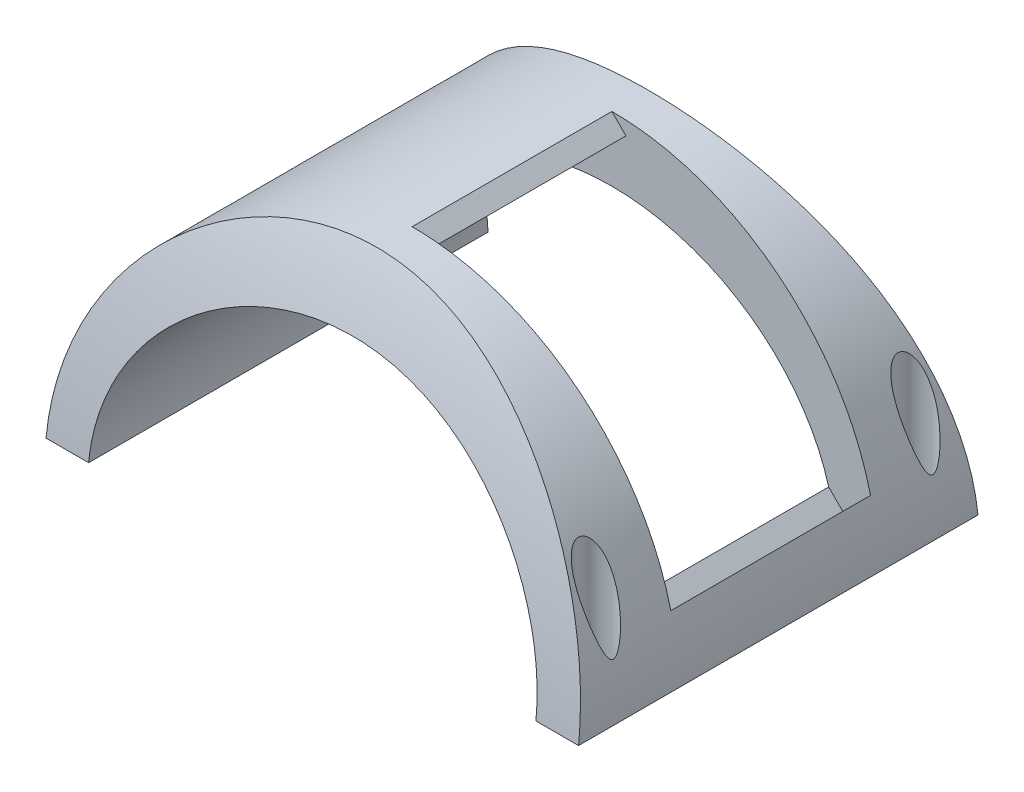
from build123d import *

# Parameters (mm, degrees)
SKETCH1_W               = 101.6
SKETCH1_H               = 76.2
BOSS_EXTRUDE1_DEPTH     = 2.54
SKETCH2_W               = 101.6
SKETCH2_H               = 76.2
BOSS_EXTRUDE2_DEPTH     = 24.638
SKETCH3_W               = 101.6
SKETCH3_H               = 76.2
BOSS_EXTRUDE3_DEPTH     = 50.8
CUT_EXTRUDE8_DEPTH      = 150.028750528
CUT_EXTRUDE9_DEPTH      = 150.0287507
CUT_EXTRUDE10_DEPTH     = 150.0287507
CUT_EXTRUDE11_DEPTH     = 150.0287507
SKETCH8_W               = 21.414745162
SKETCH8_H               = 38.1
CUT_EXTRUDE12_DEPTH     = 153.384018497
BOSS_EXTRUDE4_DEPTH     = 41.402
SKETCH10_W              = 38.1
SKETCH10_H              = 19.466312833
CUT_EXTRUDE13_DEPTH     = 19.558
BOSS_EXTRUDE5_DEPTH     = 44.958
SKETCH13_W              = 101.6
SKETCH13_H              = 27.178
CUT_EXTRUDE14_DEPTH     = 150.0287507
SKETCH14_R              = 1.7526
CUT_EXTRUDE15_DEPTH     = 150.0287507
MIRROR2_COPY_1_SKETCH_R = 1.7526
MIRROR2_COPY_1_DEPTH    = 150.0287507
MIRROR2_COPY_2_SKETCH_R = 1.7526
MIRROR2_COPY_2_DEPTH    = 150.0287507
CUT_EXTRUDE16_START     = 30.48
SKETCH16_R              = 3.3274
CUT_EXTRUDE16_DEPTH     = 119.5487507
MIRROR4_START           = 30.48
MIRROR4_COPY_1_SKETCH_R = 3.3274
MIRROR4_COPY_1_DEPTH    = 119.5487507
MIRROR4_COPY_2_SKETCH_R = 3.3274
MIRROR4_COPY_2_DEPTH    = 119.5487507


with BuildPart() as part:
    # Sketch1 → Boss-Extrude1 (new body)
    with BuildSketch(Plane(origin=(0, 0, 0), x_dir=(1, 0, 0), z_dir=(0, 1, 0))):
        with Locations((50.8, 38.1)):
            Rectangle(SKETCH1_W, SKETCH1_H)
    extrude(amount=BOSS_EXTRUDE1_DEPTH)

    # Sketch2 → Boss-Extrude2 (add)
    with BuildSketch(Plane(origin=(0, 2.54, 0), x_dir=(1, 0, 0), z_dir=(0, 1, 0))):
        with Locations((50.8, 38.1)):
            Rectangle(SKETCH2_W, SKETCH2_H)
    extrude(amount=BOSS_EXTRUDE2_DEPTH)



with BuildPart() as body_2:
    # Sketch3 → Boss-Extrude3 (new body)
    with BuildSketch(Plane(origin=(0, 27.178, 0), x_dir=(1, 0, 0), z_dir=(0, 1, 0))):
        with Locations((50.8, 38.1)):
            Rectangle(SKETCH3_W, SKETCH3_H)
    extrude(amount=BOSS_EXTRUDE3_DEPTH)

    # Sketch5 → Cut-Extrude8 (cut, through all)
    with BuildSketch(Plane.XY):
        with BuildLine():
            Line((50.8, 77.978), (0, 77.978))
            Line((0, 77.978), (0, 27.178))
            add(Edge.make_bspline(
                [(50.8, 77.978), (0, 77.978), (0, 27.178)],
                knots=[4.71238898, 4.71238898, 4.71238898, 6.283185307, 6.283185307, 6.283185307], degree=2, weights=[1, 0.707106781, 1]))
        make_face()
    extrude(amount=-CUT_EXTRUDE8_DEPTH, mode=Mode.SUBTRACT)

    # Sketch5<3> → Cut-Extrude9 (cut, through all)
    with BuildSketch(Plane.XY):
        with BuildLine():
            Line((101.6, 77.978), (50.8, 77.978))
            add(Edge.make_bspline(
                [(101.6, 27.178), (101.6, 77.978), (50.8, 77.978)],
                knots=[3.141592654, 3.141592654, 3.141592654, 4.71238898, 4.71238898, 4.71238898], degree=2, weights=[1, 0.707106781, 1]))
            Line((101.6, 27.178), (101.6, 77.978))
        make_face()
    extrude(amount=-CUT_EXTRUDE9_DEPTH, mode=Mode.SUBTRACT)

    # Sketch6 → Cut-Extrude10 (cut, through all)
    with BuildSketch(Plane(origin=(101.6, 0, 0), x_dir=(0, 0, -1), z_dir=(1, 0, 0))):
        with BuildLine():
            add(Edge.make_bspline(
                [(76.2, 27.178), (73.121610085, 57.407688579), (64.140209771, 77.978)],
                knots=[1.837829398, 1.837829398, 1.837829398, 2.426389886, 2.426389886, 2.426389886], degree=2, weights=[1, 0.957011156, 1]))
            Line((76.2, 27.178), (76.2, 77.978))
            Line((76.2, 77.978), (64.140209771, 77.978))
        make_face()
        with BuildLine():
            Line((0, 77.978), (0, 27.178))
            add(Edge.make_bspline(
                [(12.288609443, 77.978), (3.214553962, 57.407688579), (0, 27.178)],
                knots=[3.858809947, 3.858809947, 3.858809947, 4.447370436, 4.447370436, 4.447370436], degree=2, weights=[1, 0.957011156, 1]))
            Line((12.288609443, 77.978), (0, 77.978))
        make_face()
    extrude(amount=-CUT_EXTRUDE10_DEPTH, mode=Mode.SUBTRACT)

    # Sketch7 → Cut-Extrude11 (cut, through all)
    with BuildSketch(Plane.XY):
        with BuildLine():
            add(Edge.make_bspline(
                [(93.46739229, 27.178), (93.46739229, 65.621562358), (50.8, 65.621562358), (8.13260771, 65.621562358), (8.13260771, 27.178)],
                knots=[0, 0, 0, 1.570796327, 1.570796327, 3.141592654, 3.141592654, 3.141592654], degree=2, weights=[1, 0.707106781, 1, 0.707106781, 1]))
            Line((8.13260771, 27.178), (93.46739229, 27.178))
        make_face()
    extrude(amount=-CUT_EXTRUDE11_DEPTH, mode=Mode.SUBTRACT)

    # Sketch8 → Cut-Extrude12 (cut, through all)
    with BuildSketch(Plane(origin=(37.211, -37.211, 0), x_dir=(-0.7071067811865477, -0.7071067811865475, 0), z_dir=(0.7071067811865475, -0.7071067811865477, 0))):
        with Locations((-101.767169649, 38.1)):
            Rectangle(SKETCH8_W, SKETCH8_H)
    extrude(amount=-CUT_EXTRUDE12_DEPTH, mode=Mode.SUBTRACT)


with BuildPart() as part_1:
    add(part.part)

    add(body_2.part)  # Boss-Extrude4 merges body 2
    # Sketch9 → Boss-Extrude4 (add)
    with BuildSketch(Plane.XY.offset(-57.15)):
        with BuildLine():
            Line((100.152285563, 39.219258643), (94.85551346, 33.92248654))
            Line((94.85551346, 33.92248654), (101.6, 27.178))
            ThreePointArc((101.6, 27.178), (101.236772828, 33.241987689), (100.152285563, 39.219258643))
        make_face()
    extrude(amount=BOSS_EXTRUDE4_DEPTH)

    # Sketch10 → Cut-Extrude13 (cut)
    with BuildSketch(Plane(origin=(64.389, 64.389, 0), x_dir=(0, 0, -1), z_dir=(0.7071067811865476, 0.7071067811865476, 0))):
        with Locations((38.1, 8.14068705)):
            Rectangle(SKETCH10_W, SKETCH10_H)
    extrude(amount=-CUT_EXTRUDE13_DEPTH, mode=Mode.SUBTRACT)

    # Sketch12 → Boss-Extrude5 (add)
    with BuildSketch(Plane.XY.offset(-57.15)):
        with BuildLine():
            Line((53.494076836, 75.283923164), (51.750284079, 77.027715921))
            Line((51.750284079, 77.027715921), (38.789660531, 64.067092373))
            add(Edge.make_bspline(
                [(43.220238967, 65.010085295), (40.976992454, 64.64522443), (38.789660531, 64.067092373)],
                knots=[1.739495436, 1.739495436, 1.739495436, 1.856140312, 1.856140312, 1.856140312], degree=2, weights=[0.958800913, 0.977789377, 1]))
            Line((43.220238967, 65.010085295), (45.606692096, 67.396538423))
            Line((45.606692096, 67.396538423), (53.494076836, 75.283923164))
        make_face()
    extrude(amount=BOSS_EXTRUDE5_DEPTH)

    # Sketch13 → Cut-Extrude14 (cut, through all)
    with BuildSketch(Plane.XY):
        with Locations((50.8, 13.589)):
            Rectangle(SKETCH13_W, SKETCH13_H)
    extrude(amount=-CUT_EXTRUDE14_DEPTH, mode=Mode.SUBTRACT)

    # Sketch14 → Cut-Extrude15 (cut, through all)
    with BuildSketch(Plane(origin=(0, 0, 0), x_dir=(1, 0, 0), z_dir=(0, 1, 0))):
        with Locations((4.318, 68.58)):
            Circle(SKETCH14_R)
    cut_extrude15 = extrude(amount=CUT_EXTRUDE15_DEPTH, mode=Mode.SUBTRACT)

    # Mirror1: Cut-Extrude15 across plane
    add(cut_extrude15.mirror(Plane(origin=(50.8, 0, 0), x_dir=(0, 0, 1), z_dir=(1, 0, 0))), mode=Mode.SUBTRACT)

    # Mirror2 copy 1 sketch → Mirror2 copy 1 (cut, through all)
    with BuildSketch(Plane(origin=(101.6, 0, -76.2), x_dir=(-1, 0, 0), z_dir=(0, 1, 0))):
        with Locations((4.318, 68.58)):
            Circle(MIRROR2_COPY_1_SKETCH_R)
    extrude(amount=MIRROR2_COPY_1_DEPTH, mode=Mode.SUBTRACT)

    # Mirror2 copy 2 sketch → Mirror2 copy 2 (cut, through all)
    with BuildSketch(Plane(origin=(0, 0, -76.2), x_dir=(1, 0, 0), z_dir=(0, 1, 0))):
        with Locations((4.318, -68.58)):
            Circle(MIRROR2_COPY_2_SKETCH_R)
    extrude(amount=MIRROR2_COPY_2_DEPTH, mode=Mode.SUBTRACT)

    # Sketch16 → Cut-Extrude16 (cut, through all)
    with BuildSketch(Plane(origin=(0, 0, 0), x_dir=(1, 0, 0), z_dir=(0, 1, 0)).offset(CUT_EXTRUDE16_START)):
        with Locations((4.318, 68.58)):
            Circle(SKETCH16_R)
    cut_extrude16 = extrude(amount=CUT_EXTRUDE16_DEPTH, mode=Mode.SUBTRACT)

    # Mirror3: Cut-Extrude16 across plane
    add(cut_extrude16.mirror(Plane(origin=(50.8, 0, 0), x_dir=(0, 0, 1), z_dir=(1, 0, 0))), mode=Mode.SUBTRACT)

    # Mirror4 copy 1 sketch → Mirror4 copy 1 (cut, through all)
    with BuildSketch(Plane(origin=(101.6, 0, -76.2), x_dir=(-1, 0, 0), z_dir=(0, 1, 0)).offset(MIRROR4_START)):
        with Locations((4.318, 68.58)):
            Circle(MIRROR4_COPY_1_SKETCH_R)
    extrude(amount=MIRROR4_COPY_1_DEPTH, mode=Mode.SUBTRACT)

    # Mirror4 copy 2 sketch → Mirror4 copy 2 (cut, through all)
    with BuildSketch(Plane(origin=(0, 0, -76.2), x_dir=(1, 0, 0), z_dir=(0, 1, 0)).offset(MIRROR4_START)):
        with Locations((4.318, -68.58)):
            Circle(MIRROR4_COPY_2_SKETCH_R)
    extrude(amount=MIRROR4_COPY_2_DEPTH, mode=Mode.SUBTRACT)


solid = part_1.part
